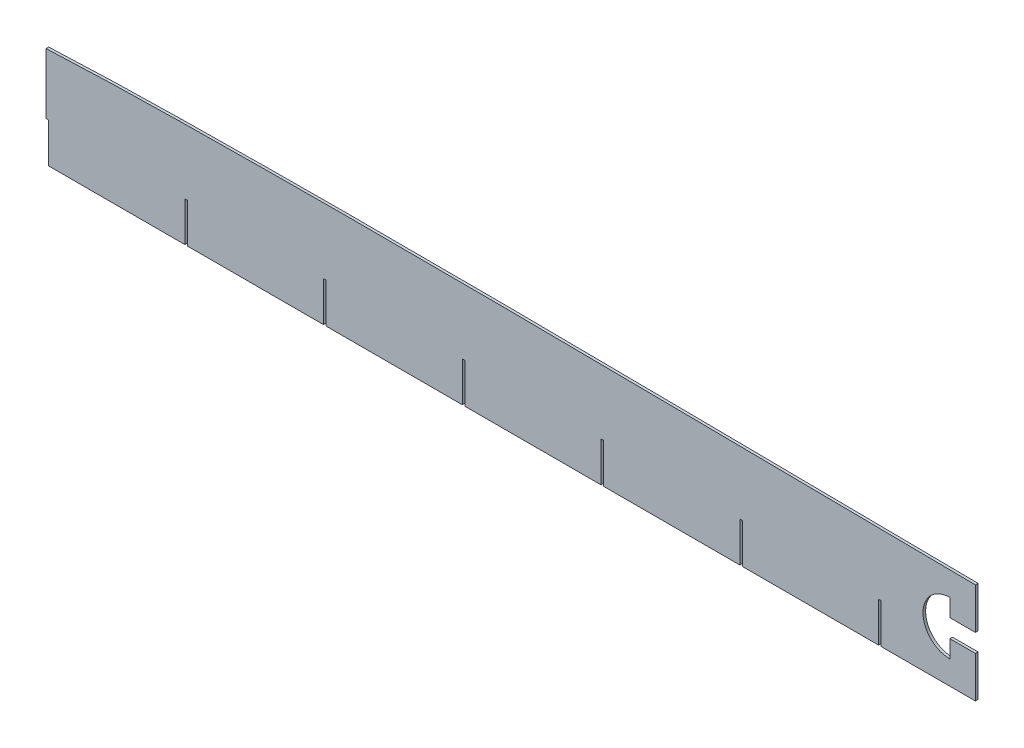
from build123d import *

# Parameters (mm, degrees)
BOSS_EXTRUDE1_DEPTH = 3


with BuildPart() as part:
    # Model → Boss-Extrude1 (new body)
    with BuildSketch(Plane.XY):
        with BuildLine():
            Line((1159.8, 315.682652611), (1159.8, 268.452661621))
            Line((1159.8, 268.452661621), (1130.6, 268.452661621))
            Line((1130.6, 268.452661621), (1130.6, 288.450029928))
            ThreePointArc((1130.6, 288.450029928), (1099.799999997, 258.052661621), (1130.6, 227.655293314))
            Line((1130.6, 227.655293314), (1130.6, 247.652661621))
            Line((1130.6, 247.652661621), (1159.8, 247.652661621))
            Line((1159.8, 247.652661621), (1159.8, 200.422661621))
            Line((1159.8, 200.422661621), (1051.901037795, 200.422661621))
            Line((1051.901037795, 200.422661621), (1051.901037795, 245.979700014))
            Line((1051.901037795, 245.979700014), (1048.901037796, 245.979700014))
            Line((1048.901037796, 245.979700014), (1048.901037796, 200.422661621))
            Line((1048.901037796, 200.422661621), (892.901037795, 200.422661621))
            Line((892.901037795, 200.422661621), (892.901037795, 245.979700014))
            Line((892.901037795, 245.979700014), (889.901037795, 245.979700014))
            Line((889.901037795, 245.979700014), (889.901037795, 200.422661621))
            Line((889.901037795, 200.422661621), (733.901037795, 200.422661621))
            Line((733.901037795, 200.422661621), (733.901037795, 245.979700014))
            Line((733.901037795, 245.979700014), (730.901037795, 245.979700014))
            Line((730.901037795, 245.979700014), (730.901037795, 200.422661621))
            Line((730.901037795, 200.422661621), (574.901037795, 200.422661621))
            Line((574.901037795, 200.422661621), (574.901037795, 245.979700014))
            Line((574.901037795, 245.979700014), (571.901037795, 245.979700014))
            Line((571.901037795, 245.979700014), (571.901037795, 200.422661621))
            Line((571.901037795, 200.422661621), (415.901037795, 200.422661621))
            Line((415.901037795, 200.422661621), (415.901037795, 245.979700014))
            Line((415.901037795, 245.979700014), (412.901037795, 245.979700014))
            Line((412.901037795, 245.979700014), (412.901037795, 200.422661621))
            Line((412.901037795, 200.422661621), (256.901037795, 200.422661621))
            Line((256.901037795, 200.422661621), (256.901037795, 245.979700014))
            Line((256.901037795, 245.979700014), (253.901037796, 245.979700014))
            Line((253.901037796, 245.979700014), (253.901037796, 200.422661621))
            Line((253.901037796, 200.422661621), (97.901037796, 200.422661621))
            Line((97.901037796, 200.422661621), (97.901037796, 245.979700014))
            Line((97.901037796, 245.979700014), (94.901037796, 245.979700014))
            Line((94.901037796, 245.979700014), (94.901037796, 315.441313757))
            add(Edge.make_bspline(
                [(247.229949675, 319.88819474), (196.438413442, 319.129990608), (145.658637693, 317.812733824), (94.901037796, 315.441313757)],
                knots=[0, 0, 0, 0, 1, 1, 1, 1], degree=3))
            add(Edge.make_bspline(
                [(247.229949675, 319.88819474), (247.232310837, 319.888229986), (247.234672013, 319.888265232), (247.237033201, 319.888300477)],
                knots=[0.554606396, 0.554606396, 0.554606396, 0.554606396, 0.554611125, 0.554611125, 0.554611125, 0.554611125], degree=3))
            add(Edge.make_bspline(
                [(1159.8, 315.682652611), (855.607338384, 318.03324125), (551.339710355, 324.427563161), (247.237033201, 319.888300477)],
                knots=[0, 0, 0, 0, 1, 1, 1, 1], degree=3))
        make_face()
    extrude(amount=BOSS_EXTRUDE1_DEPTH)


solid = part.part
